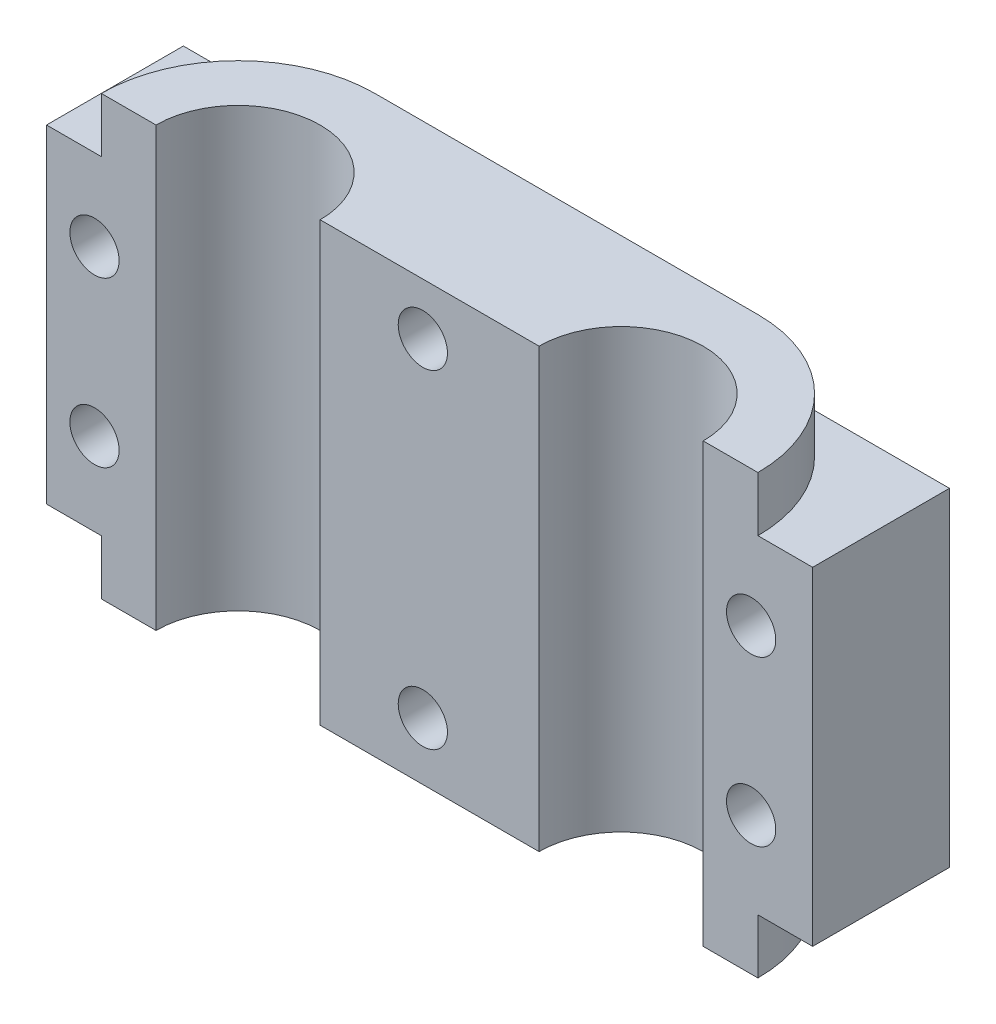
from build123d import *

# Parameters (mm, degrees)
BOSS_EXTRUDE1_DEPTH       = 20
BOSS_EXTRUDE2_DEPTH       = 15
F_1_0MM_DOWEL_HOLE1_D     = 4.5
F_1_0MM_DOWEL_HOLE1_DEPTH = 15
F_1_0MM_DOWEL_HOLE1_TIP   = 1.299038106


with BuildPart() as part:
    # Sketch1 → Boss-Extrude1 (new, symmetric)
    with BuildSketch(Plane(origin=(0, 0, 0), x_dir=(1, 0, 0), z_dir=(0, 1, 0))):
        with BuildLine():
            Line((-10, 0), (10, 0))
            ThreePointArc((10, 0), (17.5, 7.5), (25, 0))
            Line((25, 0), (30, 0))
            ThreePointArc((30, 0), (26.338834765, 8.838834765), (17.5, 12.5))
            Line((17.5, 12.5), (0, 12.5))
            Line((0, 12.5), (-17.5, 12.5))
            ThreePointArc((-17.5, 12.5), (-26.338834765, 8.838834765), (-30, 0))
            Line((-30, 0), (-25, 0))
            ThreePointArc((-25, 0), (-17.5, 7.5), (-10, 0))
        make_face()
    extrude(amount=BOSS_EXTRUDE1_DEPTH, both=True)

    # Sketch1<3> → Boss-Extrude2 (add, symmetric)
    with BuildSketch(Plane(origin=(0, 0, 0), x_dir=(1, 0, 0), z_dir=(0, 1, 0))):
        with BuildLine():
            ThreePointArc((17.5, 12.5), (26.338834765, 8.838834765), (30, 0))
            Line((30, 0), (35, 0))
            Line((35, 0), (35, 12.5))
            Line((35, 12.5), (17.5, 12.5))
        make_face()
        with BuildLine():
            Line((-35, 0), (-30, 0))
            ThreePointArc((-30, 0), (-26.338834765, 8.838834765), (-17.5, 12.5))
            Line((-17.5, 12.5), (-35, 12.5))
            Line((-35, 12.5), (-35, 0))
        make_face()
    extrude(amount=BOSS_EXTRUDE2_DEPTH, both=True)

    # Ø1.0mm Dowel Hole1
    with Locations(Plane(origin=(0, 0, -12.5), x_dir=(-1, 0, 0), z_dir=(0, 0, -1))):
        with Locations((0.618788662, -14.735944651), (-29.381211338, -7.429004746), (30.618788662, -7.429004746), (30.618788662, 7.570995254), (0.618788662, 15.264055349), (-29.381211338, 7.570995254)):
            Hole(F_1_0MM_DOWEL_HOLE1_D / 2, depth=F_1_0MM_DOWEL_HOLE1_DEPTH)
            with Locations((0, 0, -(F_1_0MM_DOWEL_HOLE1_DEPTH + F_1_0MM_DOWEL_HOLE1_TIP / 2))):  # 120° drill point
                Cone(0, F_1_0MM_DOWEL_HOLE1_D / 2, F_1_0MM_DOWEL_HOLE1_TIP, mode=Mode.SUBTRACT)


solid = part.part
